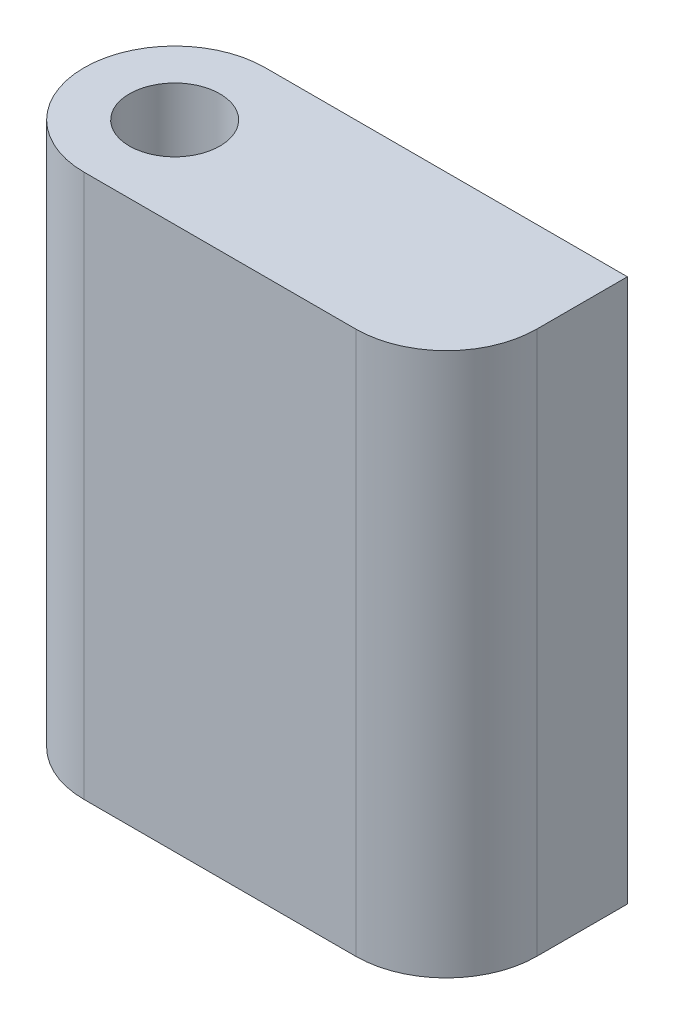
from build123d import *

# Parameters (mm, degrees)
SKETCH1_R           = 2.5
BOSS_EXTRUDE1_DEPTH = 30
FILLET1_R           = 5


with BuildPart() as part:
    # Sketch1 → Boss-Extrude1 (new body)
    with BuildSketch(Plane(origin=(0, 0, 0), x_dir=(1, 0, 0), z_dir=(0, 1, 0))):
        with BuildLine():
            Line((0, 5), (20, 5))
            Line((20, 5), (20, -5))
            Line((20, -5), (0, -5))
            ThreePointArc((0, -5), (-5, 0), (0, 5))
        make_face()
        with Locations(Location((0, 0, 0), (0, 0, 270))):
            Circle(SKETCH1_R, mode=Mode.SUBTRACT)
    extrude(amount=BOSS_EXTRUDE1_DEPTH)

    # Fillet1
    fillet1_edges = [part.edges().sort_by_distance(p)[0] for p in [
        (20, 15, 5),
    ]]
    fillet(fillet1_edges, radius=FILLET1_R)


solid = part.part
